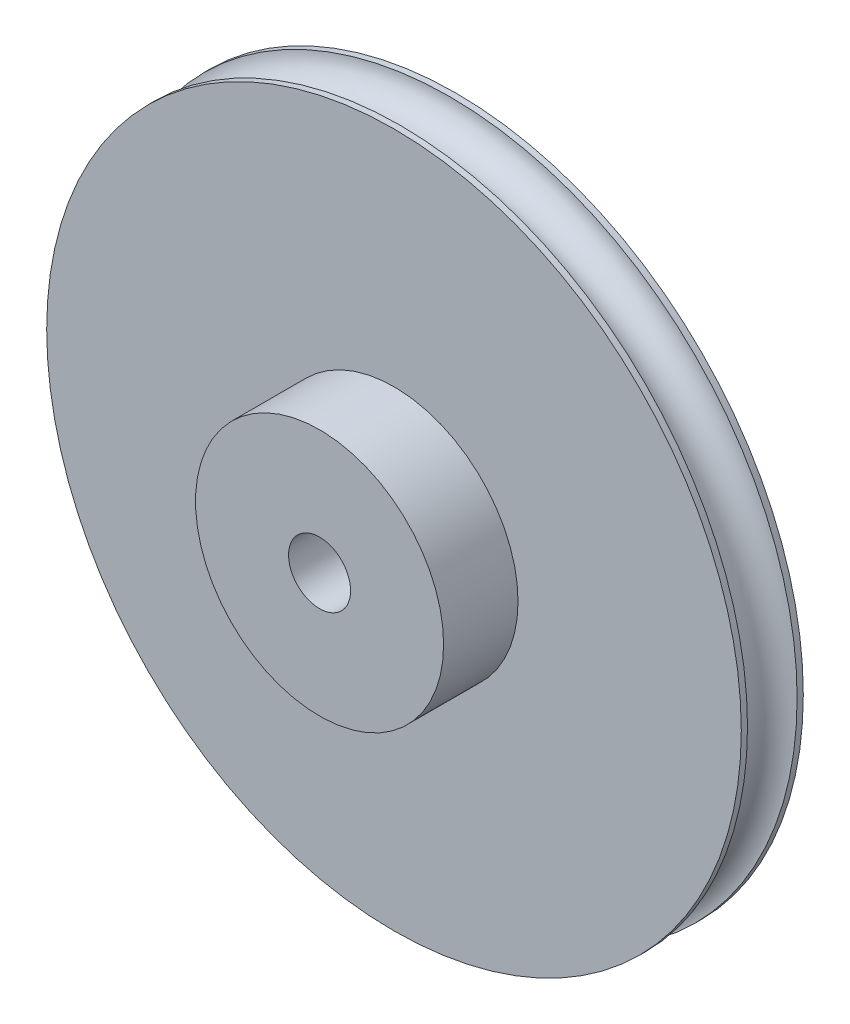
from build123d import *

# Parameters (mm, degrees)
ESQUISSE1_R             = 28
BOSS_EXTRU_1_DEPTH      = 5
ESQUISSE2_R             = 10
BOSS_EXTRU_2_DEPTH      = 6
ESQUISSE3_R             = 2.5
ENL_V_MAT_EXTRU_1_DEPTH = 42.097445176
ESQUISSE4_R             = 2


with BuildPart() as part:
    # Esquisse1 → Boss.-Extru.1 (new body)
    with BuildSketch(Plane.XY):
        Circle(ESQUISSE1_R)
    extrude(amount=BOSS_EXTRU_1_DEPTH)

    # Esquisse2 → Boss.-Extru.2 (add)
    with BuildSketch(Plane.XY.offset(5)):
        Circle(ESQUISSE2_R)
    extrude(amount=BOSS_EXTRU_2_DEPTH)

    # Esquisse3 → Enlèv. mat.-Extru.1 (cut, through all)
    with BuildSketch(Plane.XY.offset(11)):
        Circle(ESQUISSE3_R)
    extrude(amount=-ENL_V_MAT_EXTRU_1_DEPTH, mode=Mode.SUBTRACT)

    # Esquisse4 → Enlèvement de matière-Révolution1 (revolve, cut)
    with BuildSketch(Plane(origin=(0, 0, 0), x_dir=(0, 0, -1), z_dir=(1, 0, 0)), mode=Mode.PRIVATE) as enl_vement_de_mati_re_r_volution1_sk:
        with Locations((-2.5, 28)):
            Circle(ESQUISSE4_R)
    revolve(enl_vement_de_mati_re_r_volution1_sk.sketch.rotate(Axis((0, 0, 0), (0, 0, 1)), 90), axis=Axis((0, 0, 0), (0, 0, 1)), mode=Mode.SUBTRACT)


solid = part.part
